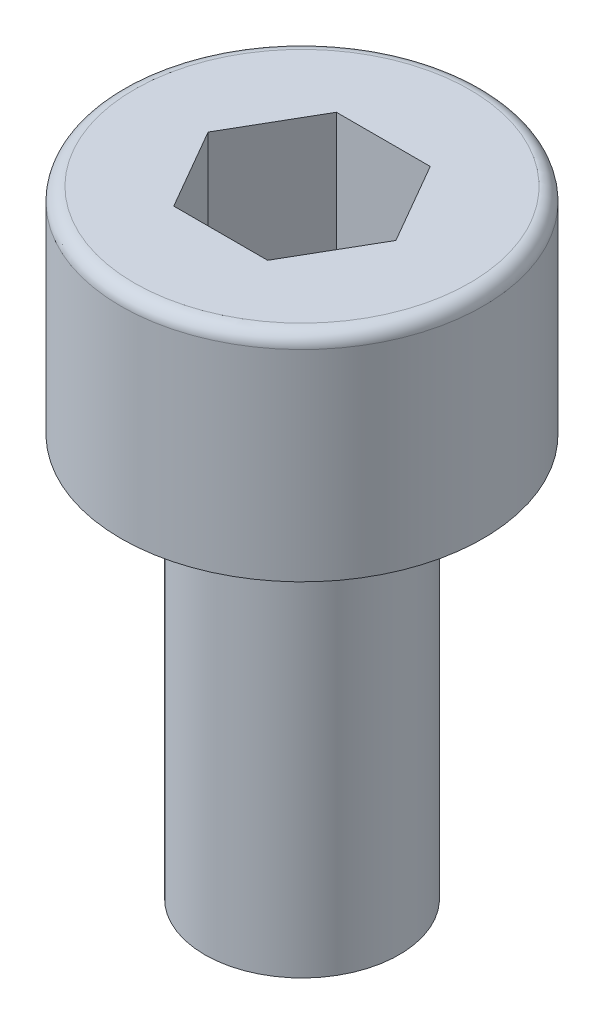
from build123d import *

# Parameters (mm, degrees)
SKETCH1_R           = 2.7
BOSS_EXTRUDE1_DEPTH = 3.2
CUT_EXTRUDE1_DEPTH  = 2
FILLET1_R           = 0.2
SKETCH3_R           = 1.45
BOSS_EXTRUDE3_DEPTH = 6


with BuildPart() as part:
    # Sketch1 → Boss-Extrude1 (new body)
    with BuildSketch(Plane(origin=(0, 0, 0), x_dir=(1, 0, 0), z_dir=(0, 1, 0))):
        with Locations(Location((0, 0, 0), (0, 0, 270))):
            Circle(SKETCH1_R)
    extrude(amount=BOSS_EXTRUDE1_DEPTH)

    # Sketch2 → Cut-Extrude1 (cut)
    with BuildSketch(Plane(origin=(0, 3.2, 0), x_dir=(1, 0, 0), z_dir=(0, 1, 0))):
        Polygon((1.4, 0), (0.7, 1.212435565), (-0.7, 1.212435565), (-1.4, 0), (-0.7, -1.212435565), (0.7, -1.212435565), align=None)
    extrude(amount=-CUT_EXTRUDE1_DEPTH, mode=Mode.SUBTRACT)

    # Fillet1
    fillet1_edges = [part.edges().sort_by_distance(p)[0] for p in [
        (0, 3.2, -2.7),
    ]]
    fillet(fillet1_edges, radius=FILLET1_R)

    # Sketch3 → Boss-Extrude3 (add)
    with BuildSketch(Plane.XZ):
        with Locations(Location((0, 0, 0), (0, 0, 270))):
            Circle(SKETCH3_R)
    extrude(amount=BOSS_EXTRUDE3_DEPTH)


solid = part.part
